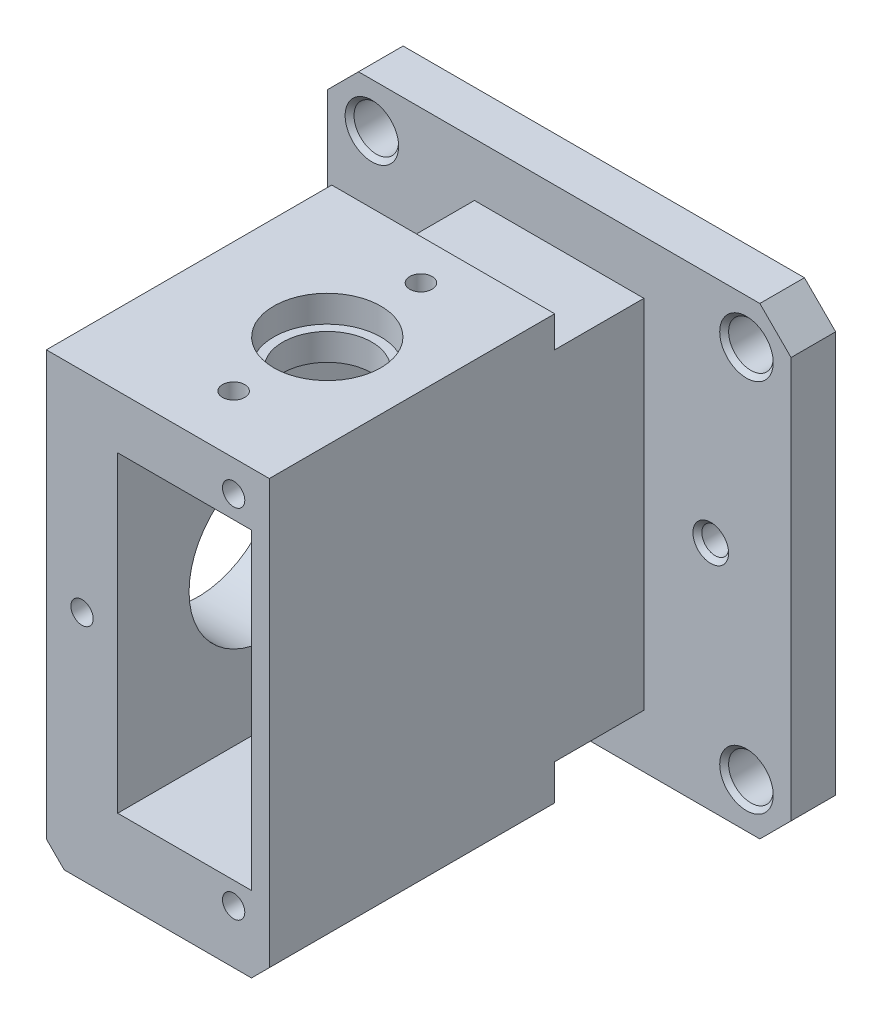
from build123d import *

# Parameters (mm, degrees)
SKETCH_1_W          = 52
SKETCH_1_H          = 52
EXTRUDE_1_DEPTH     = 5
CUT_EXTRUDE_1_DEPTH = 38.107950631
CHAMFER_1_SIZE      = 3.5
CHAMFER_2_SIZE      = 0.5
SKETCH_3_W          = 19
SKETCH_3_H          = 40
EXTRUDE_2_DEPTH     = 42
SKETCH_4_W          = 25
SKETCH_4_H          = 52
EXTRUDE_3_DEPTH     = 32
SKETCH_6_W          = 15
SKETCH_6_H          = 35
CUT_EXTRUDE_2_DEPTH = 60.674114991
CUT_EXTRUDE_3_REACH = 69.877
SKETCH_7_R          = 9
M3X0_51_D           = 2.5
M3X0_51_DEPTH       = 5.5
M3X0_51_TIP         = 0.751075774
CHAMFER_3_SIZE      = 2
M3X0_52_D           = 2.5
M3X0_52_DEPTH       = 5.5
M3X0_52_TIP         = 0.751075774
SKETCH_13_R         = 3.1
CUT_EXTRUDE_4_DEPTH = 7
CUT_EXTRUDE_5_REACH = 72.071
SKETCH_14_R         = 1.55
CHAMFER_4_SIZE      = 1
SKETCH_15_W         = 25
SKETCH_15_H         = 32
CUT_EXTRUDE_6_DEPTH = 2.5
SKETCH_16_R         = 6
CUT_EXTRUDE_7_DEPTH = 3
CUT_EXTRUDE_8_REACH = 73.044
SKETCH_17_R         = 5
M3X0_53_D           = 2.5
M3X0_53_DEPTH       = 4.5
M3X0_53_TIP         = 0.751075774
CUT_EXTRUDE_9_REACH = 61.674
SKETCH_20_R         = 1.5
CHAMFER_5_SIZE      = 0.5


with BuildPart() as part:
    # Эскиз1 → Бобышка-Вытянуть1 (new body)
    with BuildSketch(Plane.XY):
        Rectangle(SKETCH_1_W, SKETCH_1_H)
    extrude(amount=EXTRUDE_1_DEPTH)

    # Эскиз2 → Вырез-Вытянуть1 (cut, through all)
    with BuildSketch(Plane.XY.offset(5)):
        with BuildLine():
            ThreePointArc((-18.5, 21), (-22.767766953, 22.767766953), (-21, 18.5))
            Line((-21, 18.5), (-21, 21))
            Line((-21, 21), (-18.5, 21))
        make_face()
        with BuildLine():
            Line((-21, 21), (-21, 18.5))
            ThreePointArc((-21, 18.5), (-19.232233047, 19.232233047), (-18.5, 21))
            Line((-18.5, 21), (-21, 21))
        make_face()
        with BuildLine():
            ThreePointArc((18.5, 21), (19.232233047, 19.232233047), (21, 18.5))
            Line((21, 18.5), (21, 21))
            Line((21, 21), (18.5, 21))
        make_face()
        with BuildLine():
            Line((21, 21), (21, 18.5))
            ThreePointArc((21, 18.5), (22.767766953, 19.232233047), (23.5, 21))
            ThreePointArc((23.5, 21), (21, 23.5), (18.5, 21))
            Line((18.5, 21), (21, 21))
        make_face()
        with BuildLine():
            Line((-21, -18.5), (-21, -21))
            Line((-21, -21), (-18.5, -21))
            ThreePointArc((-18.5, -21), (-19.232233047, -19.232233047), (-21, -18.5))
        make_face()
        with BuildLine():
            Line((-18.5, -21), (-21, -21))
            Line((-21, -21), (-21, -18.5))
            ThreePointArc((-21, -18.5), (-22.767766953, -22.767766953), (-18.5, -21))
        make_face()
        with BuildLine():
            ThreePointArc((21, -18.5), (19.232233047, -19.232233047), (18.5, -21))
            Line((18.5, -21), (21, -21))
            Line((21, -21), (21, -18.5))
        make_face()
        with BuildLine():
            Line((21, -21), (18.5, -21))
            ThreePointArc((18.5, -21), (21, -23.5), (23.5, -21))
            ThreePointArc((23.5, -21), (22.767766953, -19.232233047), (21, -18.5))
            Line((21, -18.5), (21, -21))
        make_face()
    extrude(amount=-CUT_EXTRUDE_1_DEPTH, mode=Mode.SUBTRACT)

    # Фаска1
    chamfer_1_edges = [part.edges().sort_by_distance(p)[0] for p in [
        (26, -26, 2.5),
        (-26, -26, 2.5),
        (-26, 26, 2.5),
        (26, 26, 2.5),
    ]]
    chamfer(chamfer_1_edges, length=CHAMFER_1_SIZE)

    # Фаска2
    chamfer_2_edges = [part.edges().sort_by_distance(p)[0] for p in [
        (23.5, 21, 5),
        (-21, 23.5, 5),
        (-23.5, -21, 5),
        (18.5, -21, 5),
    ]]
    chamfer(chamfer_2_edges, length=CHAMFER_2_SIZE)

    # Эскиз3 → Бобышка-Вытянуть2 (add)
    with BuildSketch(Plane.XY.offset(5)):
        Rectangle(SKETCH_3_W, SKETCH_3_H)
    extrude(amount=EXTRUDE_2_DEPTH)

    # Эскиз4 → Бобышка-Вытянуть3 (add)
    with BuildSketch(Plane.XY.offset(47)):
        with Locations((-3, 0)):
            Rectangle(SKETCH_4_W, SKETCH_4_H)
    extrude(amount=-EXTRUDE_3_DEPTH)

    # Эскиз6 → Вырез-Вытянуть2 (cut, through all)
    with BuildSketch(Plane.XY.offset(47)):
        Rectangle(SKETCH_6_W, SKETCH_6_H)
    extrude(amount=-CUT_EXTRUDE_2_DEPTH, mode=Mode.SUBTRACT)

    # Эскиз7 → Вырез-Вытянуть3 (cut, up to next)
    with BuildSketch(Plane.ZY.offset(15.5), mode=Mode.PRIVATE) as cut_extrude_3_sk1:
        with Locations((30, 0)):
            Circle(SKETCH_7_R)
    cut_extrude_3_tool1 = extrude(cut_extrude_3_sk1.sketch, amount=-CUT_EXTRUDE_3_REACH, mode=Mode.PRIVATE) & part.part
    add(cut_extrude_3_tool1.solids().sort_by_distance((-15.5, 0, 30))[0], mode=Mode.SUBTRACT)

    # Отверстие обработанное метчиком M3x0.51
    with Locations(Plane(origin=(-15.5, 11, 39), x_dir=(0, 0, -1), z_dir=(-1, 0, 0))):
        with Locations((0, 0), (0, 22), (18, 22), (18, 0)):
            Hole(M3X0_51_D / 2, depth=M3X0_51_DEPTH)
            with Locations((0, 0, -(M3X0_51_DEPTH + M3X0_51_TIP / 2))):  # 118° drill point
                Cone(0, M3X0_51_D / 2, M3X0_51_TIP, mode=Mode.SUBTRACT)

    # Фаска3
    chamfer_3_edges = [part.edges().sort_by_distance(p)[0] for p in [
        (9.5, 26, 31),
        (9.5, -26, 31),
        (-15.5, -26, 31),
        (-15.5, 26, 31),
    ]]
    chamfer(chamfer_3_edges, length=CHAMFER_3_SIZE)

    # Отверстие обработанное метчиком M3x0.52
    with Locations(Plane(origin=(5.5, 20, 47), x_dir=(1, 0, 0), z_dir=(0, 0, 1))):
        with Locations((0, 0), (-17, -20), (0, -40)):
            Hole(M3X0_52_D / 2, depth=M3X0_52_DEPTH)
            with Locations((0, 0, -(M3X0_52_DEPTH + M3X0_52_TIP / 2))):  # 118° drill point
                Cone(0, M3X0_52_D / 2, M3X0_52_TIP, mode=Mode.SUBTRACT)

    # Эскиз13 → Вырез-Вытянуть4 (cut)
    with BuildSketch(Plane(origin=(0, -26, 0), x_dir=(-1, 0, 0), z_dir=(0, -1, 0))):
        with Locations(Location((1, -30, 0), (0, 0, 90))):
            Circle(SKETCH_13_R)
    extrude(amount=-CUT_EXTRUDE_4_DEPTH, mode=Mode.SUBTRACT)

    # Эскиз14 → Вырез-Вытянуть5 (cut, up to next)
    with BuildSketch(Plane.XZ.offset(19), mode=Mode.PRIVATE) as cut_extrude_5_sk1:
        with Locations(Location((-1, 30, 0), (0, 0, 270))):
            Circle(SKETCH_14_R)
    cut_extrude_5_tool1 = extrude(cut_extrude_5_sk1.sketch, amount=-CUT_EXTRUDE_5_REACH, mode=Mode.PRIVATE) & part.part
    add(cut_extrude_5_tool1.solids().sort_by_distance((-1, -19, 30))[0], mode=Mode.SUBTRACT)

    # Фаска4
    chamfer_4_edges = [part.edges().sort_by_distance(p)[0] for p in [
        (-1, -26, 33.1),
    ]]
    chamfer(chamfer_4_edges, length=CHAMFER_4_SIZE)

    # Эскиз15 → Вырез-Вытянуть6 (cut)
    with BuildSketch(Plane(origin=(0, 26, 0), x_dir=(1, 0, 0), z_dir=(0, 1, 0))):
        with Locations((-3, -31)):
            Rectangle(SKETCH_15_W, SKETCH_15_H)
    extrude(amount=-CUT_EXTRUDE_6_DEPTH, mode=Mode.SUBTRACT)

    # Эскиз16 → Вырез-Вытянуть7 (cut)
    with BuildSketch(Plane(origin=(0, 23.5, 0), x_dir=(1, 0, 0), z_dir=(0, 1, 0))):
        with Locations(Location((-1, -30, 0), (0, 0, 270))):
            Circle(SKETCH_16_R)
    extrude(amount=-CUT_EXTRUDE_7_DEPTH, mode=Mode.SUBTRACT)

    # Эскиз17 → Вырез-Вытянуть8 (cut, up to next)
    with BuildSketch(Plane(origin=(0, 20.5, 0), x_dir=(1, 0, 0), z_dir=(0, 1, 0)), mode=Mode.PRIVATE) as cut_extrude_8_sk1:
        with Locations(Location((-1, -30, 0), (0, 0, 270))):
            Circle(SKETCH_17_R)
    cut_extrude_8_tool1 = extrude(cut_extrude_8_sk1.sketch, amount=-CUT_EXTRUDE_8_REACH, mode=Mode.PRIVATE) & part.part
    add(cut_extrude_8_tool1.solids().sort_by_distance((-1, 20.5, 30))[0], mode=Mode.SUBTRACT)

    # Отверстие обработанное метчиком M3x0.53
    with Locations(Plane(origin=(-1, 23.5, 40.5), x_dir=(0, 0, 1), z_dir=(0, 1, 0))):
        with Locations((0, 0), (-21, 0)):
            Hole(M3X0_53_D / 2, depth=M3X0_53_DEPTH)
            with Locations((0, 0, -(M3X0_53_DEPTH + M3X0_53_TIP / 2))):  # 118° drill point
                Cone(0, M3X0_53_D / 2, M3X0_53_TIP, mode=Mode.SUBTRACT)

    # Эскиз20 → Вырез-Вытянуть9 (cut, up to next)
    with BuildSketch(Plane(origin=(0, 0, 0), x_dir=(-1, 0, 0), z_dir=(0, 0, -1)), mode=Mode.PRIVATE) as cut_extrude_9_sk1:
        with Locations((-17, 0)):
            Circle(SKETCH_20_R)
    cut_extrude_9_tool1 = extrude(cut_extrude_9_sk1.sketch, amount=-CUT_EXTRUDE_9_REACH, mode=Mode.PRIVATE) & part.part
    # Эскиз20 → Вырез-Вытянуть9 (cut, up to next)
    with BuildSketch(Plane(origin=(0, 0, 0), x_dir=(-1, 0, 0), z_dir=(0, 0, -1)), mode=Mode.PRIVATE) as cut_extrude_9_sk2:
        with Locations((17, 0)):
            Circle(SKETCH_20_R)
    cut_extrude_9_tool2 = extrude(cut_extrude_9_sk2.sketch, amount=-CUT_EXTRUDE_9_REACH, mode=Mode.PRIVATE) & part.part
    add(cut_extrude_9_tool1.solids().sort_by_distance((17, 0, 0))[0], mode=Mode.SUBTRACT)
    add(cut_extrude_9_tool2.solids().sort_by_distance((-17, 0, 0))[0], mode=Mode.SUBTRACT)

    # Фаска5
    chamfer_5_edges = [part.edges().sort_by_distance(p)[0] for p in [
        (18.5, 0, 5),
        (-15.5, 0, 5),
    ]]
    chamfer(chamfer_5_edges, length=CHAMFER_5_SIZE)


solid = part.part
